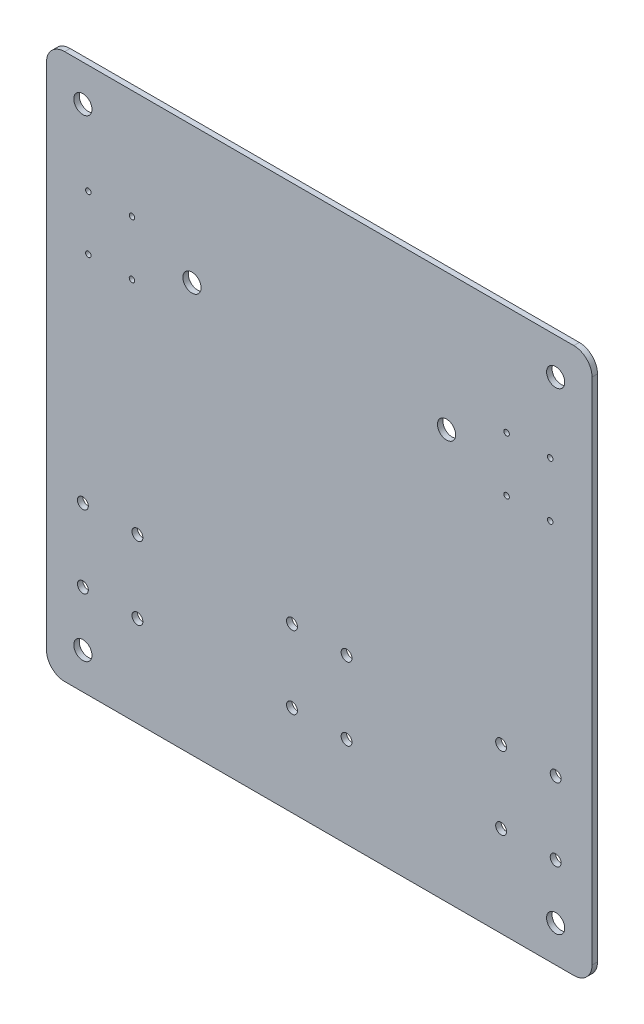
from build123d import *

# Parameters (mm, degrees)
SKETCH_1_W               = 300
SKETCH_1_H               = 300
EXTRUDE_1_DEPTH          = 3
SKETCH_2_R               = 1.5
CUT_EXTRUDE_1_DEPTH      = 213.153246499
FILLET_1_R               = 10
SKETCH_3_R               = 5
CUT_EXTRUDE_2_DEPTH      = 213.153246499
MIRROR_3_COPY_1_SKETCH_R = 5
MIRROR_3_COPY_1_DEPTH    = 213.153246499
SKETCH_4_R               = 5
CUT_EXTRUDE_3_DEPTH      = 213.153246499
SKETCH_5_R               = 3
CUT_EXTRUDE_4_DEPTH      = 213.153246499
SKETCH_6_R               = 3
CUT_EXTRUDE_5_DEPTH      = 213.153246499


with BuildPart() as part:
    # 草图1 → 凸台-拉伸1 (new body)
    with BuildSketch(Plane.XY):
        Rectangle(SKETCH_1_W, SKETCH_1_H)
    extrude(amount=EXTRUDE_1_DEPTH)

    # 草图2 → 切除-拉伸1 (cut, through all)
    with BuildSketch(Plane.XY.offset(3)):
        with Locations((103, 90)):
            Circle(SKETCH_2_R)
        with Locations((127, 90)):
            Circle(SKETCH_2_R)
        with Locations((103, 60)):
            Circle(SKETCH_2_R)
        with Locations((127, 60)):
            Circle(SKETCH_2_R)
    cut_extrude_1 = extrude(amount=-CUT_EXTRUDE_1_DEPTH, mode=Mode.SUBTRACT)

    # 镜向1: 切除-拉伸1 across plane
    add(cut_extrude_1.mirror(Plane(origin=(0, 0, 0), x_dir=(0, 0, 1), z_dir=(1, 0, 0))), mode=Mode.SUBTRACT)

    # 圆角1
    fillet_1_edges = [part.edges().sort_by_distance(p)[0] for p in [
        (-150, 150, 1.5),
        (150, 150, 1.5),
        (150, -150, 1.5),
        (-150, -150, 1.5),
    ]]
    fillet(fillet_1_edges, radius=FILLET_1_R)

    # 草图3 → 切除-拉伸2 (cut, through all)
    with BuildSketch(Plane.XY.offset(3)):
        with Locations((-130, 130)):
            Circle(SKETCH_3_R)
    cut_extrude_2 = extrude(amount=-CUT_EXTRUDE_2_DEPTH, mode=Mode.SUBTRACT)

    # 镜向2: 切除-拉伸2 across plane
    add(cut_extrude_2.mirror(Plane(origin=(0, 0, 0), x_dir=(0, 0, 1), z_dir=(1, 0, 0))), mode=Mode.SUBTRACT)

    # 镜向3: 切除-拉伸2 across plane
    add(cut_extrude_2.mirror(Plane.ZX), mode=Mode.SUBTRACT)

    # 镜向3 copy 1 sketch → 镜向3 copy 1 (cut, through all)
    with BuildSketch(Plane(origin=(0, 0, 3), x_dir=(-1, 0, 0), z_dir=(0, 0, 1))):
        with Locations((-130, 130)):
            Circle(MIRROR_3_COPY_1_SKETCH_R)
    extrude(amount=-MIRROR_3_COPY_1_DEPTH, mode=Mode.SUBTRACT)

    # 草图4 → 切除-拉伸3 (cut, through all)
    with BuildSketch(Plane.XY.offset(3)):
        with Locations((-70, 75)):
            Circle(SKETCH_4_R)
        with Locations((70, 75)):
            Circle(SKETCH_4_R)
    extrude(amount=-CUT_EXTRUDE_3_DEPTH, mode=Mode.SUBTRACT)

    # 草图5 → 切除-拉伸4 (cut, through all)
    with BuildSketch(Plane.XY.offset(3)):
        with Locations((-130, -100)):
            Circle(SKETCH_5_R)
        with Locations((-130, -60)):
            Circle(SKETCH_5_R)
        with Locations((-100, -60)):
            Circle(SKETCH_5_R)
        with Locations((-100, -100)):
            Circle(SKETCH_5_R)
    cut_extrude_4 = extrude(amount=-CUT_EXTRUDE_4_DEPTH, mode=Mode.SUBTRACT)

    # 镜向4: 切除-拉伸4 across plane
    add(cut_extrude_4.mirror(Plane(origin=(0, 0, 0), x_dir=(0, 0, 1), z_dir=(1, 0, 0))), mode=Mode.SUBTRACT)

    # 草图6 → 切除-拉伸5 (cut, through all)
    with BuildSketch(Plane.XY.offset(3)):
        with Locations((-15, -60)):
            Circle(SKETCH_6_R)
        with Locations((15, -60)):
            Circle(SKETCH_6_R)
        with Locations((-15, -100)):
            Circle(SKETCH_6_R)
        with Locations((15, -100)):
            Circle(SKETCH_6_R)
    extrude(amount=-CUT_EXTRUDE_5_DEPTH, mode=Mode.SUBTRACT)


solid = part.part
